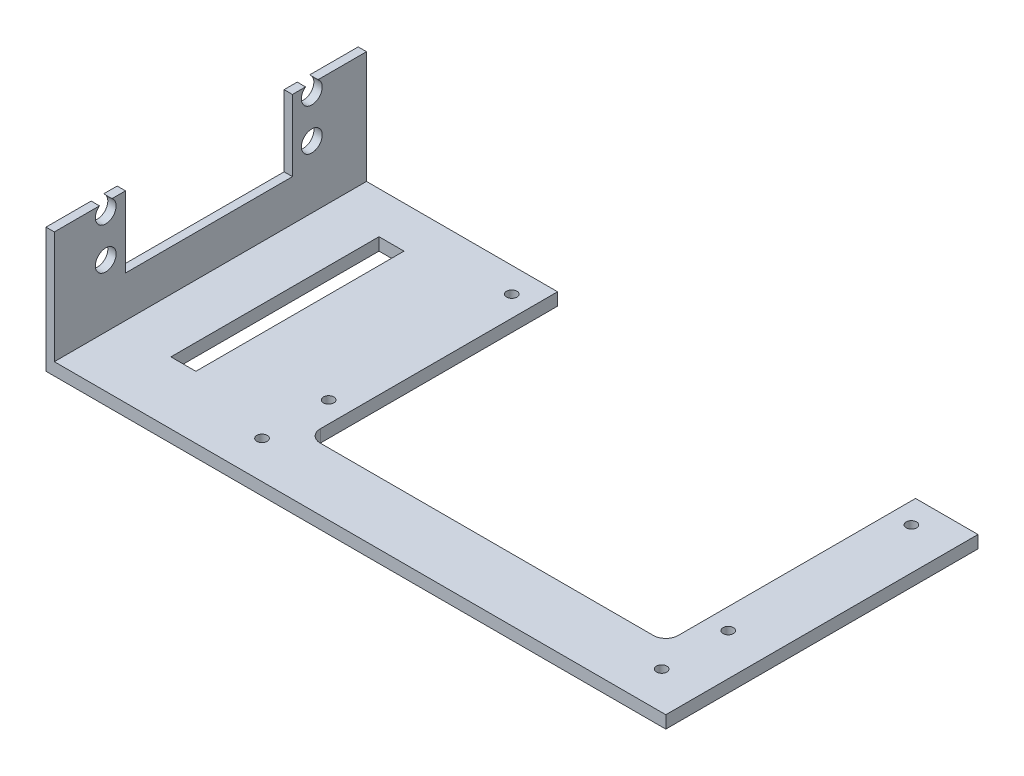
from build123d import *

# Parameters (mm, degrees)
SKETCH_1_R          = 1.25
EXTRUDE_1_DEPTH     = 3
FILLET_1_R          = 3
SKETCH_2_W          = 75
SKETCH_2_H          = 3
EXTRUDE_2_DEPTH     = 32.9
SKETCH_3_W          = 2
SKETCH_3_H          = 75
EXTRUDE_4_DEPTH     = 30
CUT_EXTRUDE_1_REACH = 164.076
SKETCH_5_W          = 40.1
SKETCH_5_H          = 20.1
CUT_EXTRUDE_2_REACH = 165.891
SKETCH_6_R          = 2.5
SKETCH_7_W          = 2
SKETCH_7_H          = 75
CUT_EXTRUDE_3_DEPTH = 3
SKETCH_9_W          = 6
SKETCH_9_H          = 50
CUT_EXTRUDE_4_DEPTH = 121.540449642


with BuildPart() as part:
    # 草图1 → 凸台-拉伸1 (new body)
    with BuildSketch(Plane(origin=(0, 0, 0), x_dir=(1, 0, 0), z_dir=(0, 1, 0))):
        Polygon((0, 0), (0, 60), (-15, 60), (-15, -15), (101, -15), (101, 60), (86, 60), (86, 0), align=None)
        with Locations(Location((-5, 54, 0), (0, 0, 270))):
            Circle(SKETCH_1_R, mode=Mode.SUBTRACT)
        with Locations(Location((-5, -6, 0), (0, 0, 90))):
            Circle(SKETCH_1_R, mode=Mode.SUBTRACT)
        with Locations(Location((91, 54, 0), (0, 0, 270))):
            Circle(SKETCH_1_R, mode=Mode.SUBTRACT)
        with Locations(Location((91, -6, 0), (0, 0, 270))):
            Circle(SKETCH_1_R, mode=Mode.SUBTRACT)
        with Locations(Location((91, 10, 0), (0, 0, 270))):
            Circle(SKETCH_1_R, mode=Mode.SUBTRACT)
        with Locations(Location((-5, 10, 0), (0, 0, 90))):
            Circle(SKETCH_1_R, mode=Mode.SUBTRACT)
    extrude(amount=EXTRUDE_1_DEPTH)

    # 圆角1
    fillet_1_edges = [part.edges().sort_by_distance(p)[0] for p in [
        (86, 1.5, 0),
        (0, 1.5, 0),
    ]]
    fillet(fillet_1_edges, radius=FILLET_1_R)

    # 草图2 → 凸台-拉伸2 (add)
    with BuildSketch(Plane.ZY.offset(15)):
        with Locations((-22.5, 1.5)):
            Rectangle(SKETCH_2_W, SKETCH_2_H)
    extrude(amount=EXTRUDE_2_DEPTH)

    # 草图3 → 凸台-拉伸4 (add)
    with BuildSketch(Plane(origin=(0, 3, 0), x_dir=(1, 0, 0), z_dir=(0, 1, 0))):
        with Locations((-46.9, 22.5)):
            Rectangle(SKETCH_3_W, SKETCH_3_H)
    extrude(amount=EXTRUDE_4_DEPTH)

    # 草图5 → 切除-拉伸1 (cut, up to next)
    with BuildSketch(Plane(origin=(-45.9, 0, 0), x_dir=(0, 0, -1), z_dir=(1, 0, 0)), mode=Mode.PRIVATE) as cut_extrude_1_sk1:
        with Locations((22.15, 22.95)):
            Rectangle(SKETCH_5_W, SKETCH_5_H)
    cut_extrude_1_tool1 = extrude(cut_extrude_1_sk1.sketch, amount=-CUT_EXTRUDE_1_REACH, mode=Mode.PRIVATE) & part.part
    add(cut_extrude_1_tool1.solids().sort_by_distance((-45.9, 22.95, -22.15))[0], mode=Mode.SUBTRACT)

    # 草图6 → 切除-拉伸2 (cut, up to next)
    with BuildSketch(Plane.ZY.offset(47.9), mode=Mode.PRIVATE) as cut_extrude_2_sk1:
        with Locations(Location((-46.85, 18, 0), (0, 0, 270))):
            Circle(SKETCH_6_R)
    cut_extrude_2_tool1 = extrude(cut_extrude_2_sk1.sketch, amount=-CUT_EXTRUDE_2_REACH, mode=Mode.PRIVATE) & part.part
    # 草图6 → 切除-拉伸2 (cut, up to next)
    with BuildSketch(Plane.ZY.offset(47.9), mode=Mode.PRIVATE) as cut_extrude_2_sk2:
        with Locations(Location((-46.85, 28, 0), (0, 0, 270))):
            Circle(SKETCH_6_R)
    cut_extrude_2_tool2 = extrude(cut_extrude_2_sk2.sketch, amount=-CUT_EXTRUDE_2_REACH, mode=Mode.PRIVATE) & part.part
    # 草图6 → 切除-拉伸2 (cut, up to next)
    with BuildSketch(Plane.ZY.offset(47.9), mode=Mode.PRIVATE) as cut_extrude_2_sk3:
        with Locations(Location((2.65, 18, 0), (0, 0, 270))):
            Circle(SKETCH_6_R)
    cut_extrude_2_tool3 = extrude(cut_extrude_2_sk3.sketch, amount=-CUT_EXTRUDE_2_REACH, mode=Mode.PRIVATE) & part.part
    # 草图6 → 切除-拉伸2 (cut, up to next)
    with BuildSketch(Plane.ZY.offset(47.9), mode=Mode.PRIVATE) as cut_extrude_2_sk4:
        with Locations(Location((2.65, 28, 0), (0, 0, 270))):
            Circle(SKETCH_6_R)
    cut_extrude_2_tool4 = extrude(cut_extrude_2_sk4.sketch, amount=-CUT_EXTRUDE_2_REACH, mode=Mode.PRIVATE) & part.part
    add(cut_extrude_2_tool1.solids().sort_by_distance((-47.9, 18, -46.85))[0], mode=Mode.SUBTRACT)
    add(cut_extrude_2_tool2.solids().sort_by_distance((-47.9, 28, -46.85))[0], mode=Mode.SUBTRACT)
    add(cut_extrude_2_tool3.solids().sort_by_distance((-47.9, 18, 2.65))[0], mode=Mode.SUBTRACT)
    add(cut_extrude_2_tool4.solids().sort_by_distance((-47.9, 28, 2.65))[0], mode=Mode.SUBTRACT)

    # 草图7 → 切除-拉伸3 (cut)
    with BuildSketch(Plane(origin=(0, 33, 0), x_dir=(1, 0, 0), z_dir=(0, 1, 0))):
        with Locations((-46.9, 22.5)):
            Rectangle(SKETCH_7_W, SKETCH_7_H)
    extrude(amount=-CUT_EXTRUDE_3_DEPTH, mode=Mode.SUBTRACT)

    # 草图9 → 切除-拉伸4 (cut, through all)
    with BuildSketch(Plane(origin=(0, 3, 0), x_dir=(1, 0, 0), z_dir=(0, 1, 0))):
        with Locations((-29.9, 25)):
            Rectangle(SKETCH_9_W, SKETCH_9_H)
    extrude(amount=-CUT_EXTRUDE_4_DEPTH, mode=Mode.SUBTRACT)


solid = part.part
